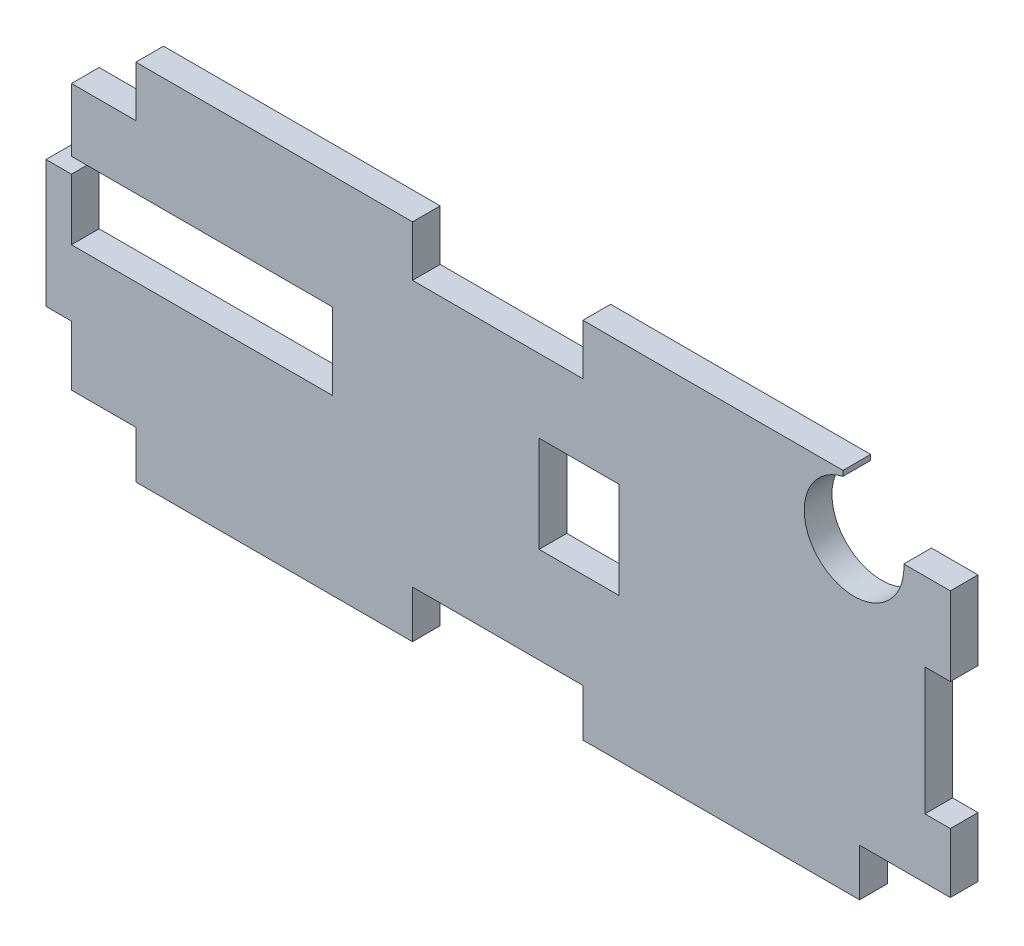
from build123d import *

# Parameters (mm, degrees)
BOSS_EXTRUDE1_DEPTH = 3.175
SKETCH2_R           = 5.715
SKETCH2_W           = 29.972
SKETCH2_H           = 8.79475
SKETCH2_W_2         = 9.144
SKETCH2_H_2         = 11.049
CUT_EXTRUDE1_DEPTH  = 5.4356
SKETCH3_W           = 1.905
SKETCH3_H           = 1.235097614
CUT_EXTRUDE2_DEPTH  = 57.808955425
SKETCH4_W           = 5.501032945
SKETCH4_H           = 1.016
SKETCH4_W_2         = 19.558
SKETCH4_W_3         = 7.3914
CUT_EXTRUDE3_DEPTH  = 57.808955425
SKETCH5_W           = 31.75
SKETCH5_H           = 0.635
SKETCH5_W_2         = 29.845
CUT_EXTRUDE4_DEPTH  = 57.808955425


with BuildPart() as part:
    # Sketch1 → Boss-Extrude1 (new body)
    with BuildSketch(Plane.XY):
        Polygon((-51.8414, 0), (-51.8414, 7.3152), (-48.9204, 7.3152), (-48.9204, 17.3482), (-41.529, 17.3482), (-41.529, 22.7838), (-9.779, 22.7838), (-9.779, 17.3482), (9.779, 17.3482), (9.779, 22.7838), (41.529, 22.7838), (41.529, 17.3482), (51.943, 17.3482), (51.943, 7.3152), (49.022, 7.3152), (49.022, 0), (49.022, -7.2898), (51.943, -7.2898), (51.943, -14.1478), (41.529, -14.1478), (41.529, -19.5834), (9.779, -19.5834), (9.779, -14.1478), (-9.779, -14.1478), (-9.779, -19.5834), (-41.529, -19.5834), (-41.529, -14.1478), (-48.9204, -14.1478), (-48.9204, -7.2898), (-51.8414, -7.2898), align=None)
    extrude(amount=BOSS_EXTRUDE1_DEPTH)

    # Sketch2 → Cut-Extrude1 (cut)
    with BuildSketch(Plane.XY.offset(3.175)):
        with Locations((40.894, 15.9766)):
            Circle(SKETCH2_R)
        with Locations((-33.9344, 4.695825)):
            Rectangle(SKETCH2_W, SKETCH2_H)
        with Locations((9.3218, 2.3876)):
            Rectangle(SKETCH2_W_2, SKETCH2_H_2)
    extrude(amount=-CUT_EXTRUDE1_DEPTH, mode=Mode.SUBTRACT)

    # Sketch3 → Cut-Extrude2 (cut, through all)
    with BuildSketch(Plane.XY.offset(3.175)):
        with Locations((40.5765, 22.166251193)):
            Rectangle(SKETCH3_W, SKETCH3_H)
    extrude(amount=-CUT_EXTRUDE2_DEPTH, mode=Mode.SUBTRACT)

    # Sketch4 → Cut-Extrude3 (cut, through all)
    with BuildSketch(Plane.XY.offset(3.175)):
        with Locations((49.192483528, 16.8402)):
            Rectangle(SKETCH4_W, SKETCH4_H)
        with Locations((0, 16.8402)):
            Rectangle(SKETCH4_W_2, SKETCH4_H)
        with Locations((-45.2247, 16.8402)):
            Rectangle(SKETCH4_W_3, SKETCH4_H)
    extrude(amount=-CUT_EXTRUDE3_DEPTH, mode=Mode.SUBTRACT)

    # Sketch5 → Cut-Extrude4 (cut, through all)
    with BuildSketch(Plane.XY.offset(3.175)):
        with Locations((-25.654, 22.4663)):
            Rectangle(SKETCH5_W, SKETCH5_H)
        with Locations((24.7015, 22.4663)):
            Rectangle(SKETCH5_W_2, SKETCH5_H)
    extrude(amount=-CUT_EXTRUDE4_DEPTH, mode=Mode.SUBTRACT)


solid = part.part
